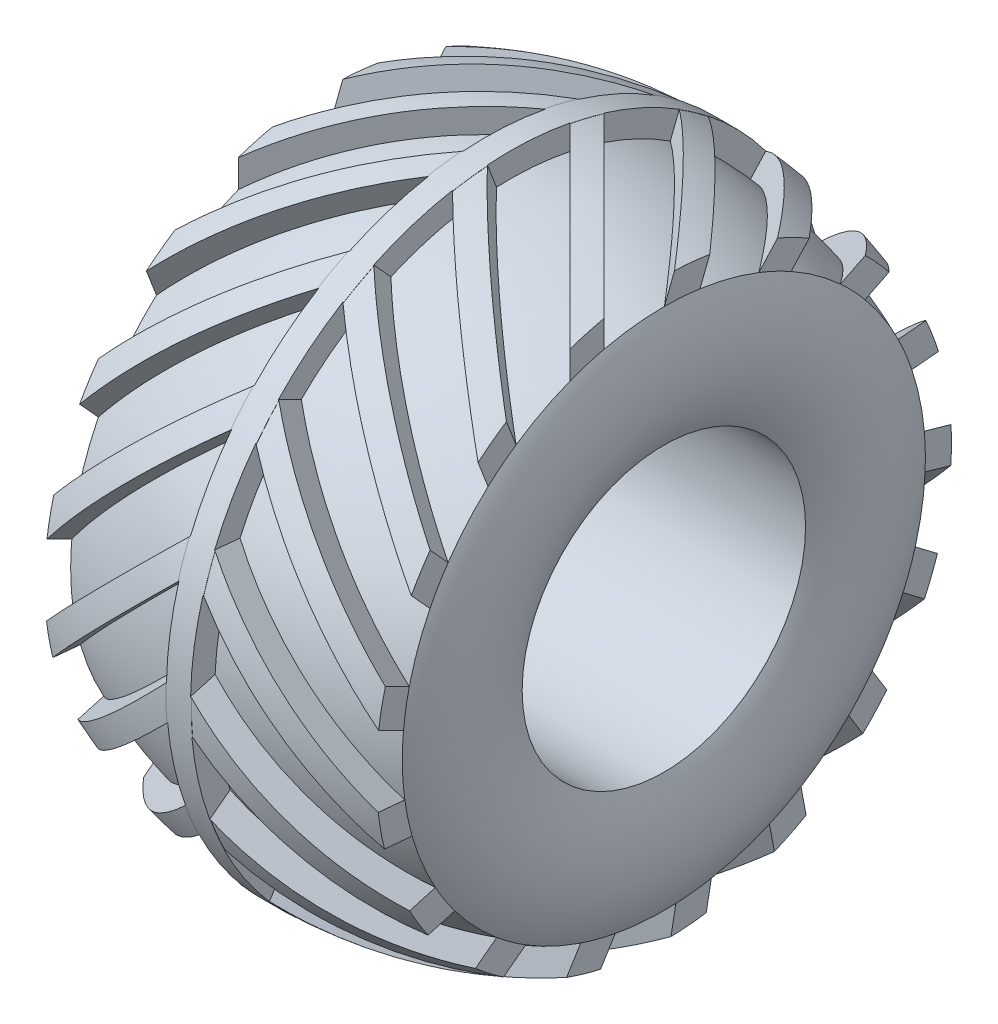
from build123d import *

# Parameters (mm, degrees)
BOSS_EXTRUDE1_REACH      = 104.947
BOSS_EXTRUDE1_END_RADIUS = 53
CIRPATTERN1_COUNT        = 17


with BuildPart() as part:
    # Sketch1 → Revolve1 (revolve)
    with BuildSketch(Plane.XY, mode=Mode.PRIVATE) as revolve1_sk:
        with BuildLine():
            Line((-27.5, 23.5), (27.5, 23.5))
            ThreePointArc((27.5, 23.5), (30, 33.435982974), (27.5, 43.371965948))
            ThreePointArc((27.5, 43.371965948), (15.01336002, 47.371039344), (2, 48.971422738))
            Line((2, 48.971422738), (2, 53))
            Line((2, 53), (-2, 53))
            Line((-2, 53), (-2, 48.971422738))
            ThreePointArc((-2, 48.971422738), (-15.01336002, 47.371039344), (-27.5, 43.371965948))
            ThreePointArc((-27.5, 43.371965948), (-30, 33.435982974), (-27.5, 23.5))
        make_face()
    revolve(revolve1_sk.sketch.rotate(Axis((0, 0, 0), (1, 0, 0)), 90), axis=Axis((0, 0, 0), (1, 0, 0)))

    # Boss-Extrude1: up to this cylinder (the profile starts inside it)
    boss_extrude1_end = Plane(origin=(0, 0, 0), z_dir=(-1, 0, 0)) * Cylinder(BOSS_EXTRUDE1_END_RADIUS, 346.394, mode=Mode.PRIVATE)
    # Sketch2 → Boss-Extrude1 (add, up to the surface)
    with BuildSketch(Plane(origin=(0, 30, 0), x_dir=(1, 0, 0), z_dir=(0, 1, 0)), mode=Mode.PRIVATE) as boss_extrude1_sk1:
        Polygon((2, 15.578427125), (27.5, -9.921572875), (27.5, -15.578427125), (2, 9.921572875), align=None)
    boss_extrude1_tool1 = extrude(boss_extrude1_sk1.sketch, amount=BOSS_EXTRUDE1_REACH, mode=Mode.PRIVATE) & boss_extrude1_end
    # Sketch2 → Boss-Extrude1 (add, up to the surface)
    with BuildSketch(Plane(origin=(0, 30, 0), x_dir=(1, 0, 0), z_dir=(0, 1, 0)), mode=Mode.PRIVATE) as boss_extrude1_sk2:
        Polygon((-2, 9.921572875), (-2, 15.578427125), (-27.5, -9.921572875), (-27.5, -15.578427125), align=None)
    boss_extrude1_tool2 = extrude(boss_extrude1_sk2.sketch, amount=BOSS_EXTRUDE1_REACH, mode=Mode.PRIVATE) & boss_extrude1_end
    boss_extrude1 = boss_extrude1_tool1.solids().sort_by_distance((14.75, 30, 0))[0] + boss_extrude1_tool2.solids().sort_by_distance((-14.75, 30, 0))[0]
    add(boss_extrude1)

    # CirPattern1: Boss-Extrude1 ×17 about axis
    cirpattern1_axis = Axis((0, 0, 0), (1, 0, 0))
    for i in range(1, CIRPATTERN1_COUNT):
        add(boss_extrude1.rotate(cirpattern1_axis, i * 360 / CIRPATTERN1_COUNT))

    # Sketch3 → Cut-Revolve1 (revolve, cut)
    with BuildSketch(Plane.XY, mode=Mode.PRIVATE) as cut_revolve1_sk:
        with BuildLine():
            Line((-29.071428571, 47.050364002), (-29.071428571, 58.228856353))
            Line((-29.071428571, 58.228856353), (-2.114285714, 58.228856353))
            Line((-2.114285714, 58.228856353), (-2.114285714, 52.969789752))
            ThreePointArc((-2.114285714, 52.969789752), (-15.871266307, 51.277955877), (-29.071428571, 47.050364002))
        make_face()
        with BuildLine():
            Line((2.114285714, 52.969789752), (2.114285714, 58.228856353))
            Line((2.114285714, 58.228856353), (29.071428571, 58.228856353))
            Line((29.071428571, 58.228856353), (29.071428571, 47.050364002))
            ThreePointArc((29.071428571, 47.050364002), (15.871266307, 51.277955877), (2.114285714, 52.969789752))
        make_face()
    revolve(cut_revolve1_sk.sketch.rotate(Axis((-200000, 0, 0), (1, 0, 0)), 88.918025277), axis=Axis((-200000, 0, 0), (1, 0, 0)), mode=Mode.SUBTRACT)


solid = part.part
